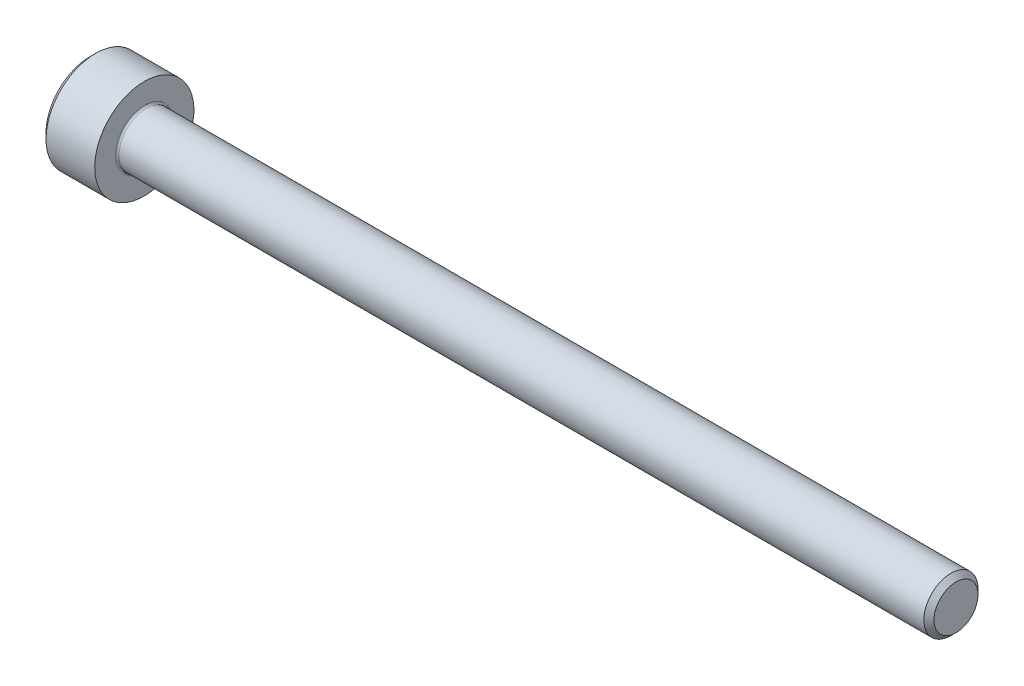
from build123d import *

# Parameters (mm, degrees)
FILLET1_R   = 0.1
HEX_2_DEPTH = 1.3


with BuildPart() as part:
    # BodySke → Base-Revolve (revolve)
    with BuildSketch(Plane.XY, mode=Mode.PRIVATE) as base_revolve_sk:
        Polygon((0, 0), (0, 2.45), (0.3, 2.75), (3, 2.75), (3, 1.5), (47.7195, 1.5), (48, 1.2195), (48, 0), align=None)
    revolve(base_revolve_sk.sketch.rotate(Axis((-31.75, 0, 0), (1, 0, 0)), 90), axis=Axis((-31.75, 0, 0), (1, 0, 0)))

    # Fillet1
    fillet1_edges = [part.edges().sort_by_distance(p)[0] for p in [
        (3, 0, -1.5),
    ]]
    fillet(fillet1_edges, radius=FILLET1_R)

    # Sketch2 → Hex-PreBroach (revolve, cut)
    with BuildSketch(Plane.XY, mode=Mode.PRIVATE) as hex_prebroach_sk:
        Polygon((0, 1.28), (1.3, 1.28), (2.039008345, 0), (0, 0), align=None)
    revolve(hex_prebroach_sk.sketch.rotate(Axis((0, 0, 0), (1, 0, 0)), 90), axis=Axis((0, 0, 0), (1, 0, 0)), mode=Mode.SUBTRACT)

    # Sketch3 → Hex 2 (cut)
    with BuildSketch(Plane(origin=(0, 0, 0), x_dir=(0, 0.500000000000001, 0.866025403784438), z_dir=(-1, 0, 0))):
        Polygon((0.739008345, 1.28), (-0.739008345, 1.28), (-1.478016689, 0), (-0.739008345, -1.28), (0.739008345, -1.28), (1.478016689, 0), align=None)
    extrude(amount=-HEX_2_DEPTH, mode=Mode.SUBTRACT)


solid = part.part
